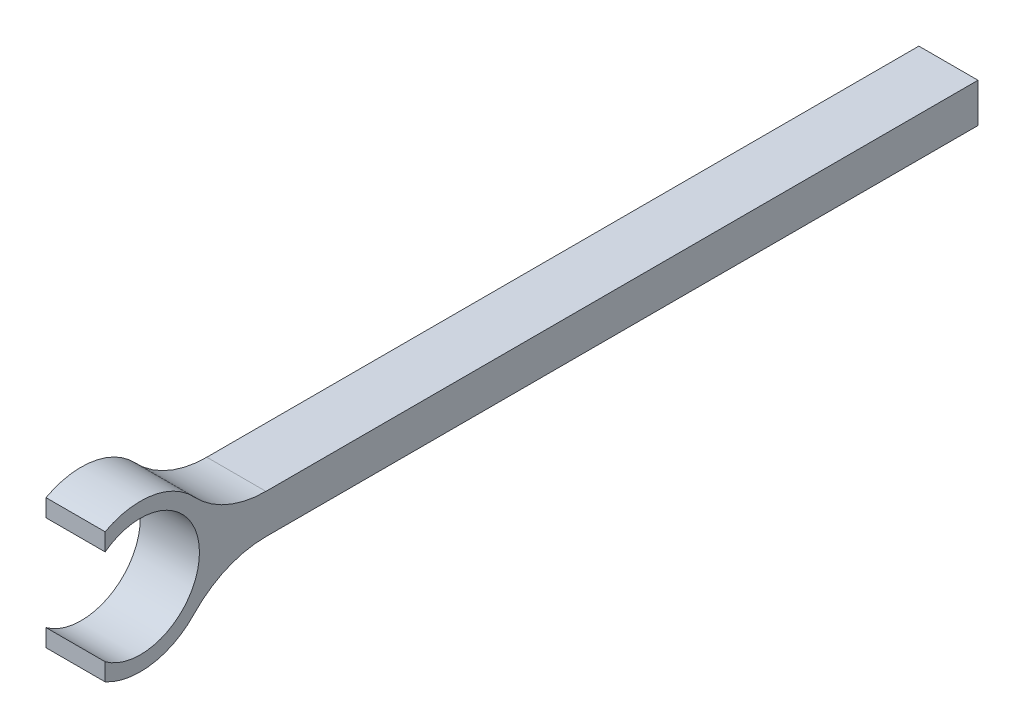
from build123d import *

# Parameters (mm, degrees)
BOSS_EXTRUDE1_DEPTH = 6
FILLET1_R           = 10


with BuildPart() as part:
    # Sketch1 → Boss-Extrude1 (new body)
    with BuildSketch(Plane(origin=(0, 0, 0), x_dir=(0, 0, -1), z_dir=(1, 0, 0))):
        with BuildLine():
            ThreePointArc((7.23115504, 1.990074568), (2.942582115, 6.898638307), (-3.56853515, 6.596632238))
            Line((-3.56853515, 6.596632238), (-3.56853515, 4.823438285))
            ThreePointArc((-3.56853515, 4.823438285), (6, 0), (-3.56853515, -4.823438285))
            Line((-3.56853515, -4.823438285), (-3.56853515, -6.596632238))
            ThreePointArc((-3.56853515, -6.596632238), (2.942582115, -6.898638307), (7.23115504, -1.990074568))
            Line((7.23115504, -1.990074568), (85, -1.990074568))
            Line((85, -1.990074568), (85, 1.990074568))
            Line((85, 1.990074568), (7.23115504, 1.990074568))
        make_face()
    extrude(amount=BOSS_EXTRUDE1_DEPTH)

    # Fillet1
    fillet1_edges = [part.edges().sort_by_distance(p)[0] for p in [
        (3, 1.990074568, -7.23115504),
        (3, -1.990074568, -7.23115504),
    ]]
    fillet(fillet1_edges, radius=FILLET1_R)


solid = part.part
